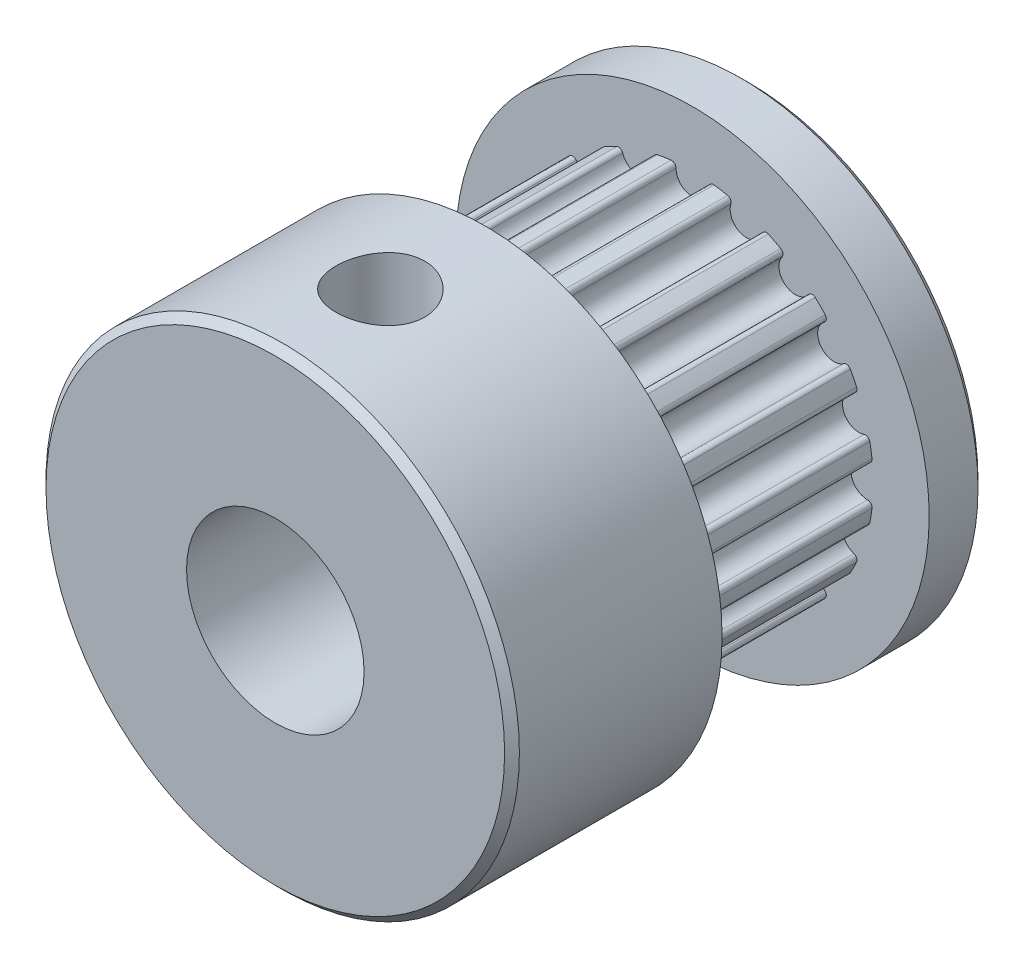
from build123d import *

# Parameters (mm, degrees)
SKETCH1_W           = 8
SKETCH1_H           = 1.9
BOSS_EXTRUDE1_DEPTH = 7
SKETCH3_R           = 8
BOSS_EXTRUDE2_DEPTH = 7.1
SKETCH4_R           = 3
CUT_EXTRUDE1_DEPTH  = 20.595917942
SKETCH6_W           = 1.5
SKETCH6_H           = 8
CHAMFER1_SIZE       = 0.25
FILLET1_R           = 0.15


with BuildPart() as part:
    # Sketch1 → Revolve1 (revolve)
    with BuildSketch(Plane(origin=(0, 0, 0), x_dir=(1, 0, 0), z_dir=(0, 1, 0))):
        with Locations((4, 0.95)):
            Rectangle(SKETCH1_W, SKETCH1_H)
    revolve(axis=Axis((0, 0, -1.9), (0, 0, 1)))

    # Sketch2 → Boss-Extrude1 (add)
    with BuildSketch(Plane.XY):
        with BuildLine():
            ThreePointArc((0.52761747, -6.087176669), (0, -5.36), (-0.52761747, -6.087176669))
            ThreePointArc((-0.52761747, -6.087176669), (-0.955814581, -6.034775761), (-1.379247006, -5.952291802))
            ThreePointArc((-1.379247006, -5.952291802), (-1.65633109, -5.097662927), (-2.382835071, -5.626206273))
            ThreePointArc((-2.382835071, -5.626206273), (-2.773881953, -5.444049863), (-3.151101175, -5.234755141))
            ThreePointArc((-3.151101175, -5.234755141), (-3.150528952, -4.33633109), (-4.004804174, -4.614503606))
            ThreePointArc((-4.004804174, -4.614503606), (-4.320422433, -4.320422433), (-4.614503606, -4.004804174))
            ThreePointArc((-4.614503606, -4.004804174), (-4.33633109, -3.150528952), (-5.234755141, -3.151101175))
            ThreePointArc((-5.234755141, -3.151101175), (-5.444049863, -2.773881953), (-5.626206273, -2.382835071))
            ThreePointArc((-5.626206273, -2.382835071), (-5.097662927, -1.65633109), (-5.952291802, -1.379247006))
            ThreePointArc((-5.952291802, -1.379247006), (-6.034775761, -0.955814581), (-6.087176669, -0.52761747))
            ThreePointArc((-6.087176669, -0.52761747), (-5.36, 0), (-6.087176669, 0.52761747))
            ThreePointArc((-6.087176669, 0.52761747), (-6.034775761, 0.955814581), (-5.952291802, 1.379247006))
            ThreePointArc((-5.952291802, 1.379247006), (-5.097662927, 1.65633109), (-5.626206273, 2.382835071))
            ThreePointArc((-5.626206273, 2.382835071), (-5.444049863, 2.773881953), (-5.234755141, 3.151101175))
            ThreePointArc((-5.234755141, 3.151101175), (-4.33633109, 3.150528952), (-4.614503606, 4.004804174))
            ThreePointArc((-4.614503606, 4.004804174), (-4.320422433, 4.320422433), (-4.004804174, 4.614503606))
            ThreePointArc((-4.004804174, 4.614503606), (-3.150528952, 4.33633109), (-3.151101175, 5.234755141))
            ThreePointArc((-3.151101175, 5.234755141), (-2.773881953, 5.444049863), (-2.382835071, 5.626206273))
            ThreePointArc((-2.382835071, 5.626206273), (-1.65633109, 5.097662927), (-1.379247006, 5.952291802))
            ThreePointArc((-1.379247006, 5.952291802), (-0.955814581, 6.034775761), (-0.52761747, 6.087176669))
            ThreePointArc((-0.52761747, 6.087176669), (0, 5.36), (0.52761747, 6.087176669))
            ThreePointArc((0.52761747, 6.087176669), (0.955814581, 6.034775761), (1.379247006, 5.952291802))
            ThreePointArc((1.379247006, 5.952291802), (1.65633109, 5.097662927), (2.382835071, 5.626206273))
            ThreePointArc((2.382835071, 5.626206273), (2.773881953, 5.444049863), (3.151101175, 5.234755141))
            ThreePointArc((3.151101175, 5.234755141), (3.150528952, 4.33633109), (4.004804174, 4.614503606))
            ThreePointArc((4.004804174, 4.614503606), (4.320422433, 4.320422433), (4.614503606, 4.004804174))
            ThreePointArc((4.614503606, 4.004804174), (4.33633109, 3.150528952), (5.234755141, 3.151101175))
            ThreePointArc((5.234755141, 3.151101175), (5.444049863, 2.773881953), (5.626206273, 2.382835071))
            ThreePointArc((5.626206273, 2.382835071), (5.097662927, 1.65633109), (5.952291802, 1.379247006))
            ThreePointArc((5.952291802, 1.379247006), (6.034775761, 0.955814581), (6.087176669, 0.52761747))
            ThreePointArc((6.087176669, 0.52761747), (5.36, 0), (6.087176669, -0.52761747))
            ThreePointArc((6.087176669, -0.52761747), (6.034775761, -0.955814581), (5.952291802, -1.379247006))
            ThreePointArc((5.952291802, -1.379247006), (5.097662927, -1.65633109), (5.626206273, -2.382835071))
            ThreePointArc((5.626206273, -2.382835071), (5.444049863, -2.773881953), (5.234755141, -3.151101175))
            ThreePointArc((5.234755141, -3.151101175), (4.33633109, -3.150528952), (4.614503606, -4.004804174))
            ThreePointArc((4.614503606, -4.004804174), (4.320422433, -4.320422433), (4.004804174, -4.614503606))
            ThreePointArc((4.004804174, -4.614503606), (3.150528952, -4.33633109), (3.151101175, -5.234755141))
            ThreePointArc((3.151101175, -5.234755141), (2.773881953, -5.444049863), (2.382835071, -5.626206273))
            ThreePointArc((2.382835071, -5.626206273), (1.65633109, -5.097662927), (1.379247006, -5.952291802))
            ThreePointArc((1.379247006, -5.952291802), (0.955814581, -6.034775761), (0.52761747, -6.087176669))
        make_face()
    extrude(amount=BOSS_EXTRUDE1_DEPTH)

    # Sketch3 → Boss-Extrude2 (add)
    with BuildSketch(Plane(origin=(0, 0, 7), x_dir=(-1, 0, 0), z_dir=(0, 0, -1))):
        with Locations(Location((0, 0, 0), (0, 0, 180))):
            Circle(SKETCH3_R)
    extrude(amount=-BOSS_EXTRUDE2_DEPTH)

    # Sketch4 → Cut-Extrude1 (cut, through all)
    with BuildSketch(Plane.XY.offset(14.1)):
        Circle(SKETCH4_R)
    extrude(amount=-CUT_EXTRUDE1_DEPTH, mode=Mode.SUBTRACT)

    # Sketch6 → Ø3.0) Diameter Hole2 (revolve, cut)
    with BuildSketch(Plane(origin=(0, 0, 10.55), x_dir=(0, 0, -1), z_dir=(1, 0, 0))):
        with Locations((0.75, 4)):
            Rectangle(SKETCH6_W, SKETCH6_H)
    revolve(axis=Axis((0, -6.35, 10.55), (0, 1, 0)), mode=Mode.SUBTRACT)

    # Chamfer1
    chamfer1_edges = [part.edges().sort_by_distance(p)[0] for p in [
        (-8, 0, 14.1),
        (-8, 0, -1.9),
    ]]
    chamfer(chamfer1_edges, length=CHAMFER1_SIZE)

    # Fillet1
    fillet1_edges = [part.edges().sort_by_distance(p)[0] for p in [
        (0.52761747, -6.087176669, 3.5),
        (1.379247006, -5.952291802, 3.5),
        (2.382835071, -5.626206273, 3.5),
        (3.151101175, -5.234755141, 3.5),
        (4.004804174, -4.614503606, 3.5),
        (4.614503606, -4.004804174, 3.5),
        (5.234755141, -3.151101175, 3.5),
        (5.626206273, -2.382835071, 3.5),
        (5.952291802, -1.379247006, 3.5),
        (6.087176669, -0.52761747, 3.5),
        (6.087176669, 0.52761747, 3.5),
        (5.952291802, 1.379247006, 3.5),
        (5.626206273, 2.382835071, 3.5),
        (5.234755141, 3.151101175, 3.5),
        (4.614503606, 4.004804174, 3.5),
        (4.004804174, 4.614503606, 3.5),
        (3.151101175, 5.234755141, 3.5),
        (2.382835071, 5.626206273, 3.5),
        (1.379247006, 5.952291802, 3.5),
        (0.52761747, 6.087176669, 3.5),
        (-0.52761747, 6.087176669, 3.5),
        (-1.379247006, 5.952291802, 3.5),
        (-2.382835071, 5.626206273, 3.5),
        (-3.151101175, 5.234755141, 3.5),
        (-4.004804174, 4.614503606, 3.5),
        (-4.614503606, 4.004804174, 3.5),
        (-5.234755141, 3.151101175, 3.5),
        (-5.626206273, 2.382835071, 3.5),
        (-5.952291802, 1.379247006, 3.5),
        (-6.087176669, 0.52761747, 3.5),
        (-6.087176669, -0.52761747, 3.5),
        (-5.952291802, -1.379247006, 3.5),
        (-5.626206273, -2.382835071, 3.5),
        (-5.234755141, -3.151101175, 3.5),
        (-4.614503606, -4.004804174, 3.5),
        (-4.004804174, -4.614503606, 3.5),
        (-3.151101175, -5.234755141, 3.5),
        (-2.382835071, -5.626206273, 3.5),
        (-1.379247006, -5.952291802, 3.5),
        (-0.52761747, -6.087176669, 3.5),
    ]]
    fillet(fillet1_edges, radius=FILLET1_R)


solid = part.part
